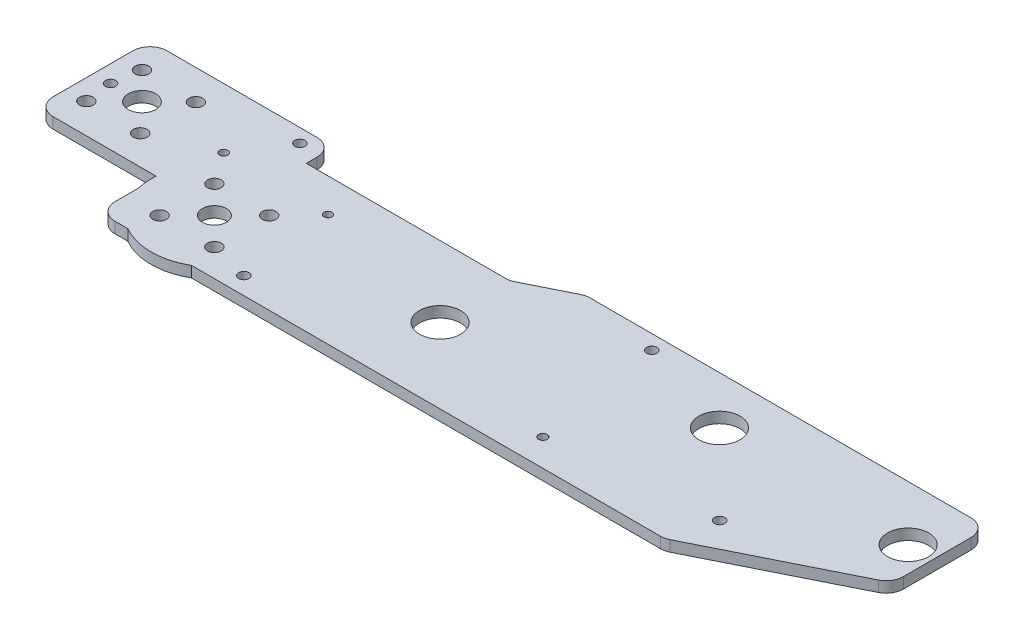
from build123d import *

# Parameters (mm, degrees)
SKETCH1_W           = 210
SKETCH1_H           = 50
SKETCH1_R           = 1.211665018
SKETCH1_R_2         = 1.165617118
SKETCH1_R_3         = 1.5
SKETCH1_R_4         = 1.25
SKETCH1_R_5         = 1.517273905
SKETCH1_R_6         = 3.4
BOSS_EXTRUDE1_DEPTH = 3.175
SKETCH2_R           = 2
CUT_EXTRUDE1_DEPTH  = 10
SKETCH3_R           = 6
SKETCH3_R_2         = 0.586995366
CUT_EXTRUDE2_DEPTH  = 57.15
CUT_EXTRUDE7_DEPTH  = 10
FILLET3_R           = 5
SKETCH11_R          = 18.5
SKETCH11_R_2        = 2
BOSS_EXTRUDE4_DEPTH = 3.175
SKETCH16_W          = 18.257640281
SKETCH16_H          = 3.175
BOSS_EXTRUDE7_DEPTH = 8.128
SKETCH17_W          = 33.3
SKETCH17_H          = 3.175
BOSS_EXTRUDE8_DEPTH = 35.56
SKETCH18_R          = 2
CUT_EXTRUDE8_DEPTH  = 9
SKETCH19_R          = 4
CUT_EXTRUDE9_DEPTH  = 40
FILLET4_R           = 5
SKETCH20_R          = 3.5
CUT_EXTRUDE10_DEPTH = 10
SKETCH21_R          = 1.5
CUT_EXTRUDE11_DEPTH = 10
SKETCH22_R          = 1.5
CUT_EXTRUDE12_DEPTH = 10
SKETCH24_R          = 1.5
CUT_EXTRUDE13_DEPTH = 10


with BuildPart() as part:
    # Sketch1 → Boss-Extrude1 (new body)
    with BuildSketch(Plane(origin=(0, 0, 0), x_dir=(1, 0, 0), z_dir=(0, 1, 0))):
        with Locations((105, -25)):
            Rectangle(SKETCH1_W, SKETCH1_H)
        with Locations(Location((3.489526233, -16.787661112, 0), (0, 0, 270))):
            Circle(SKETCH1_R, mode=Mode.SUBTRACT)
        with Locations(Location((34.37258772, -17.194005245, 0), (0, 0, 270))):
            Circle(SKETCH1_R_2, mode=Mode.SUBTRACT)
        with Locations(Location((37.520749958, -44.921198121, 0), (0, 0, 270))):
            Circle(SKETCH1_R_3, mode=Mode.SUBTRACT)
        with Locations(Location((122, -42.058139805, 0), (0, 0, 270))):
            Circle(SKETCH1_R_4, mode=Mode.SUBTRACT)
        with Locations(Location((168.975233936, -37.403209633, 0), (0, 0, 270))):
            Circle(SKETCH1_R_5, mode=Mode.SUBTRACT)
        with Locations(Location((18, -34, 0), (0, 0, 270))):
            Circle(SKETCH1_R_6, mode=Mode.SUBTRACT)
    extrude(amount=BOSS_EXTRUDE1_DEPTH)

    # Sketch2 → Cut-Extrude1 (cut)
    with BuildSketch(Plane(origin=(0, 3.175, 0), x_dir=(1, 0, 0), z_dir=(0, 1, 0))):
        with Locations(Location((10, -26, 0), (0, 0, 270))):
            Circle(SKETCH2_R)
        with Locations(Location((10, -42, 0), (0, 0, 270))):
            Circle(SKETCH2_R)
        with Locations(Location((26, -26, 0), (0, 0, 270))):
            Circle(SKETCH2_R)
        with Locations(Location((26, -42, 0), (0, 0, 270))):
            Circle(SKETCH2_R)
    extrude(amount=-CUT_EXTRUDE1_DEPTH, mode=Mode.SUBTRACT)

    # Sketch3 → Cut-Extrude2 (cut)
    with BuildSketch(Plane(origin=(0, 3.175, 0), x_dir=(1, 0, 0), z_dir=(0, 1, 0))):
        with Locations(Location((78.01026379, -28.1, 0), (0, 0, 270))):
            Circle(SKETCH3_R)
        with Locations(Location((145.531297368, -14, 0), (0, 0, 270))):
            Circle(SKETCH3_R)
        with Locations((18, -34)):
            Circle(SKETCH3_R_2)
        with Locations(Location((202.646291021, -16, 0), (0, 0, 270))):
            Circle(SKETCH3_R)
    extrude(amount=-CUT_EXTRUDE2_DEPTH, mode=Mode.SUBTRACT)

    # Sketch10 → Cut-Extrude7 (cut)
    with BuildSketch(Plane(origin=(0, 3.175, 0), x_dir=(1, 0, 0), z_dir=(0, 1, 0))):
        Polygon((210, -27.859435908), (165.502877994, -50), (210, -50), align=None)
        Polygon((92.532613397, 0), (77.65477062, -7.402812063), (0, -7.402812063), (0, 0), align=None)
    extrude(amount=-CUT_EXTRUDE7_DEPTH, mode=Mode.SUBTRACT)

    # Fillet3
    fillet3_edges = [part.edges().sort_by_distance(p)[0] for p in [
        (210, 1.5875, 0),
        (92.532613397, 1.5875, 0),
        (210, 1.5875, 27.859435908),
        (165.502877994, 1.5875, 50),
        (77.65477062, 1.5875, 7.402812063),
    ]]
    fillet(fillet3_edges, radius=FILLET3_R)

    # Sketch11 → Boss-Extrude4 (add)
    with BuildSketch(Plane(origin=(0, 3.175, 0), x_dir=(1, 0, 0), z_dir=(0, 1, 0))):
        with Locations((18, -34)):
            Circle(SKETCH11_R)
        with Locations(Location((10, -26, 0), (0, 0, 270))):
            Circle(SKETCH11_R_2, mode=Mode.SUBTRACT)
        with Locations(Location((10, -42, 0), (0, 0, 270))):
            Circle(SKETCH11_R_2, mode=Mode.SUBTRACT)
        with Locations(Location((26, -26, 0), (0, 0, 270))):
            Circle(SKETCH11_R_2, mode=Mode.SUBTRACT)
        with Locations(Location((26, -42, 0), (0, 0, 270))):
            Circle(SKETCH11_R_2, mode=Mode.SUBTRACT)
    extrude(amount=-BOSS_EXTRUDE4_DEPTH)

    # Sketch16 → Boss-Extrude7 (add)
    with BuildSketch(Plane(origin=(0, 0, 7.402812063), x_dir=(-1, 0, 0), z_dir=(0, 0, -1))):
        with Locations((-9.128820141, 1.5875)):
            Rectangle(SKETCH16_W, SKETCH16_H)
    extrude(amount=BOSS_EXTRUDE7_DEPTH)

    # Sketch17 → Boss-Extrude8 (add)
    with BuildSketch(Plane.ZY):
        with Locations((15.924812063, 1.5875)):
            Rectangle(SKETCH17_W, SKETCH17_H)
    extrude(amount=BOSS_EXTRUDE8_DEPTH)

    # Sketch18 → Cut-Extrude8 (cut)
    with BuildSketch(Plane(origin=(0, 3.175, 0), x_dir=(1, 0, 0), z_dir=(0, 1, 0))):
        with Locations(Location((-29.612034681, -23.798543698, 0), (0, 0, 270))):
            Circle(SKETCH18_R)
        with Locations(Location((-29.359661767, -7.798707515, 0), (0, 0, 270))):
            Circle(SKETCH18_R)
        with Locations(Location((-13.359825583, -8.051080428, 0), (0, 0, 270))):
            Circle(SKETCH18_R)
        with Locations(Location((-13.612198497, -24.050916612, 0), (0, 0, 270))):
            Circle(SKETCH18_R)
    extrude(amount=-CUT_EXTRUDE8_DEPTH, mode=Mode.SUBTRACT)

    # Sketch19 → Cut-Extrude9 (cut)
    with BuildSketch(Plane(origin=(0, 3.175, 0), x_dir=(1, 0, 0), z_dir=(0, 1, 0))):
        with Locations(Location((-21.359661767, -15.798707515, 0), (0, 0, 270))):
            Circle(SKETCH19_R)
    extrude(amount=-CUT_EXTRUDE9_DEPTH, mode=Mode.SUBTRACT)

    # Fillet4
    fillet4_edges = [part.edges().sort_by_distance(p)[0] for p in [
        (18.257640281, 1.5875, -0.725187937),
        (-35.56, 1.5875, -0.725187937),
        (-35.56, 1.5875, 32.574812063),
        (0, 1.5875, 50),
    ]]
    fillet(fillet4_edges, radius=FILLET4_R)

    # Sketch20 → Cut-Extrude10 (cut)
    with BuildSketch(Plane(origin=(0, 3.175, 0), x_dir=(1, 0, 0), z_dir=(0, 1, 0))):
        with Locations(Location((18, -34, 0), (0, 0, 270))):
            Circle(SKETCH20_R)
    extrude(amount=-CUT_EXTRUDE10_DEPTH, mode=Mode.SUBTRACT)

    # Sketch21 → Cut-Extrude11 (cut)
    with BuildSketch(Plane(origin=(0, 3.175, 0), x_dir=(1, 0, 0), z_dir=(0, 1, 0))):
        with Locations(Location((116, -4.237214774, 0), (0, 0, 270))):
            Circle(SKETCH21_R)
    extrude(amount=-CUT_EXTRUDE11_DEPTH, mode=Mode.SUBTRACT)

    # Sketch22 → Cut-Extrude12 (cut)
    with BuildSketch(Plane(origin=(0, 3.175, 0), x_dir=(1, 0, 0), z_dir=(0, 1, 0))):
        with Locations(Location((12.257640281, -3.274812063, 0), (0, 0, 270))):
            Circle(SKETCH22_R)
    extrude(amount=-CUT_EXTRUDE12_DEPTH, mode=Mode.SUBTRACT)

    # Sketch24 → Cut-Extrude13 (cut)
    with BuildSketch(Plane(origin=(0, 3.175, 0), x_dir=(1, 0, 0), z_dir=(0, 1, 0))):
        with Locations(Location((-30.56, -15.774812063, 0), (0, 0, 270))):
            Circle(SKETCH24_R)
    extrude(amount=-CUT_EXTRUDE13_DEPTH, mode=Mode.SUBTRACT)


solid = part.part
